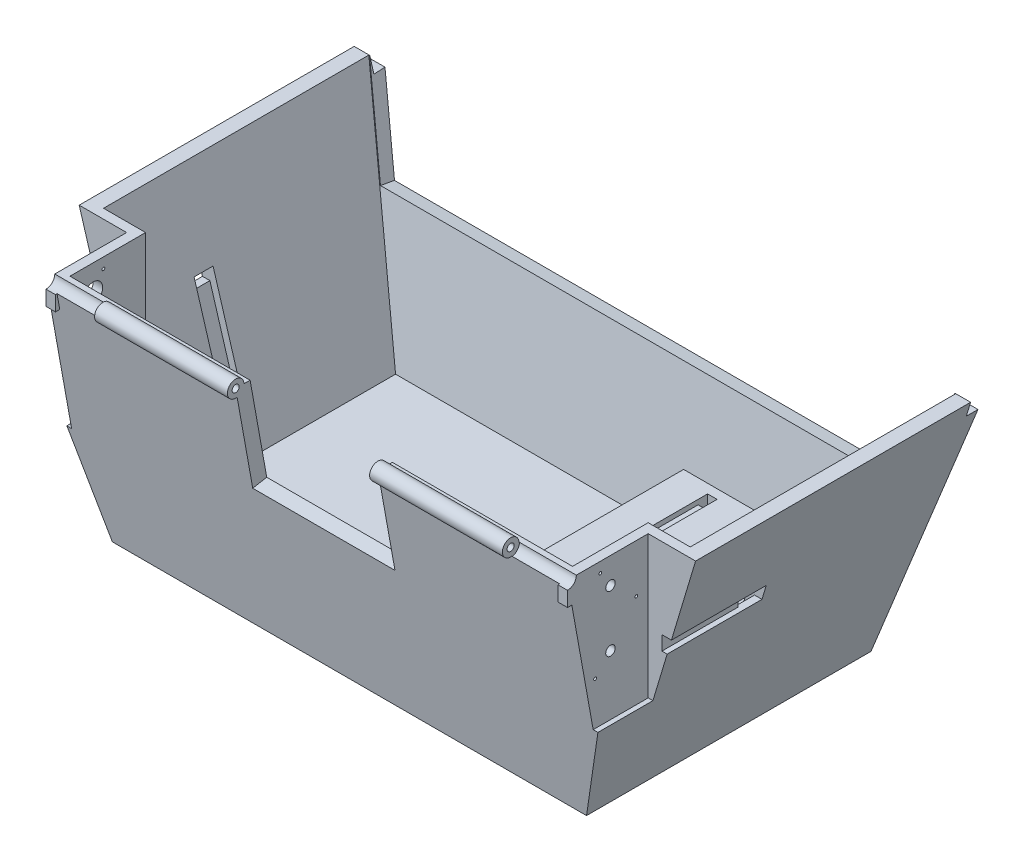
from build123d import *

# Parameters (mm, degrees)
SHELL_1_T                   = -3
CUT_EXTRUDE_START           = 55
SKETCH_4_W                  = 17
SKETCH_4_H                  = 30
CUT_EXTRUDE_1_DEPTH         = 36.807488848
CUT_EXTRUDE_START_2         = -55
SKETCH_4_2_W                = 17
SKETCH_4_2_H                = 30
CUT_EXTRUDE_2_DEPTH         = 36.807488848
EXTRUDE_START               = 55
SKETCH_4_3_W                = 17
SKETCH_4_3_H                = 30
EXTRUDE_1_DEPTH             = 2
EXTRUDE_START_2             = -55
SKETCH_4_4_W                = 17
SKETCH_4_4_H                = 30
EXTRUDE_2_DEPTH             = 2
SKETCH_5_R                  = 1.75
EXTRUDE_3_DEPTH             = 110
CUT_EXTRUDE_3_DEPTH         = 93.539856448
CUT_EXTRUDE_3_DEPTH_BACK    = 93.539856448
SKETCH_5_3_R                = 0.75
CUT_EXTRUDE_4_DEPTH         = 15
CUT_EXTRUDE_4_DEPTH_BACK    = 15
SKETCH_5_4_R                = 1.85
CUT_EXTRUDE_START_3         = -43
SKETCH_5_5_R                = 1.85
CUT_EXTRUDE_5_DEPTH         = 50.539856448
CUT_EXTRUDE_START_4         = 43
SKETCH_5_6_R                = 1.85
CUT_EXTRUDE_6_DEPTH         = 50.539856448
CUT_EXTRUDE_8_DEPTH         = 137.889097603
EXTRUDE_4_DEPTH             = 2
SKETCH_8_R                  = 0.3
SKETCH_8_R_2                = 2
CUT_EXTRUDE_9_DEPTH         = 2
SKETCH_9_R                  = 0.3
SKETCH_9_R_2                = 1
CUT_EXTRUDE_10_DEPTH        = 2
SKETCH_11_W                 = 60
SKETCH_11_H                 = 14
EXTRUDE_5_DEPTH             = 37
EXTRUDE_6_REACH             = 94.54
EXTRUDE_6_DIRECTION_2_REACH = 94.54
CUT_EXTRUDE_START_5         = -2
SKETCH_13_W                 = 36
SKETCH_13_H                 = 51
CUT_EXTRUDE_11_DEPTH        = 84.502193122
SKETCH_14_W                 = 1
SKETCH_14_H                 = 11
EXTRUDE_7_DEPTH             = 5
SKETCH_15_W                 = 8.8
SKETCH_15_H                 = 4.6
CUT_EXTRUDE_12_DEPTH        = 93.539856448
SKETCH_15_3_W               = 8.8
SKETCH_15_3_H               = 4.6
SKETCH_15_3_W_2             = 7
SKETCH_15_3_H_2             = 3
EXTRUDE_8_DEPTH             = 2
SKETCH_16_W                 = 3
SKETCH_16_H                 = 1.5
CUT_EXTRUDE_13_DEPTH        = 2
SKETCH_19_W                 = 2
SKETCH_19_H                 = 2
CUT_EXTRUDE_16_DEPTH        = 87.403848462
SKETCH_20_W                 = 19.1
SKETCH_20_H                 = 2
SKETCH_20_W_2               = 7
SKETCH_20_W_3               = 2
CUT_EXTRUDE_17_DEPTH        = 1
SKETCH_21_W                 = 24.1
SKETCH_21_H                 = 4.828212591
CUT_EXTRUDE_18_DEPTH        = 2.2
SKETCH_22_R                 = 0.75
CUT_EXTRUDE_19_DEPTH        = 3
CUT_EXTRUDE_20_DEPTH        = 3
CUT_EXTRUDE_21_DEPTH        = 93.539856448
CUT_EXTRUDE_21_DEPTH_BACK   = 93.539856448
SKETCH_24_W                 = 3
SKETCH_24_H                 = 3
SKETCH_25_W                 = 30
SKETCH_25_H                 = 20
CUT_EXTRUDE_22_DEPTH        = 108.611617512
CUT_EXTRUDE_23_DEPTH        = 20
SKETCH_27_W                 = 4
SKETCH_27_H                 = 3
CUT_EXTRUDE_24_DEPTH        = 140.438283994
SKETCH_28_W                 = 4
SKETCH_28_H                 = 17.604490414
CUT_EXTRUDE_25_DEPTH        = 1.5
SKETCH_29_W                 = 41.504647475
SKETCH_29_H                 = 4
CUT_EXTRUDE_26_DEPTH        = 1
SKETCH_30_W                 = 4
SKETCH_30_H                 = 29.088827574
CUT_EXTRUDE_27_DEPTH        = 1.5


with BuildPart() as part:
    # 草图1 → 放样1 section 0
    with BuildSketch(Plane(origin=(0, 0, 0), x_dir=(1, 0, 0), z_dir=(0, 1, 0))):
        with BuildLine():
            Line((-50, -30), (50, -30))
            Line((50, -30), (50, 30))
            Line((50, 30), (-50, 30))
            Line((-50, 30), (-50, -30))
        make_face()
    # 草图2 → 放样1 section 1
    with BuildSketch(Plane(origin=(0, 50, 0), x_dir=(1, 0, 0), z_dir=(0, 1, 0))):
        with BuildLine():
            Line((-65, -39), (65, -39))
            Line((65, -39), (65, 39))
            Line((65, 39), (-65, 39))
            Line((-65, 39), (-65, -39))
        make_face()
    loft()

    # 抽壳1
    shell_1_openings = [part.faces().sort_by_distance(p)[0] for p in [
        (0, 50, 0),
    ]]
    offset(amount=SHELL_1_T, openings=shell_1_openings, kind=Kind.INTERSECTION)

    # 草图4 → 切除-拉伸1 (cut, through all)
    with BuildSketch(Plane(origin=(0, 0, 0), x_dir=(0, 0, -1), z_dir=(1, 0, 0)).offset(CUT_EXTRUDE_START)):
        with Locations((-30.5, 35)):
            Rectangle(SKETCH_4_W, SKETCH_4_H)
    extrude(amount=CUT_EXTRUDE_1_DEPTH, mode=Mode.SUBTRACT)

    # 草图4<2> → 切除-拉伸2 (cut, through all)
    with BuildSketch(Plane(origin=(0, 0, 0), x_dir=(0, 0, -1), z_dir=(1, 0, 0)).offset(CUT_EXTRUDE_START_2)):
        with Locations((-30.5, 35)):
            Rectangle(SKETCH_4_2_W, SKETCH_4_2_H)
    extrude(amount=-CUT_EXTRUDE_2_DEPTH, mode=Mode.SUBTRACT)

    # 草图4<3> → 凸台-拉伸1 (add)
    with BuildSketch(Plane(origin=(0, 0, 0), x_dir=(0, 0, -1), z_dir=(1, 0, 0)).offset(EXTRUDE_START)):
        with Locations((-30.5, 35)):
            Rectangle(SKETCH_4_3_W, SKETCH_4_3_H)
    extrude(amount=-EXTRUDE_1_DEPTH)

    # 草图4<4> → 凸台-拉伸2 (add)
    with BuildSketch(Plane(origin=(0, 0, 0), x_dir=(0, 0, -1), z_dir=(1, 0, 0)).offset(EXTRUDE_START_2)):
        with Locations((-30.5, 35)):
            Rectangle(SKETCH_4_4_W, SKETCH_4_4_H)
    extrude(amount=EXTRUDE_2_DEPTH)

    # 草图5 → 凸台-拉伸3 (add)
    with BuildSketch(Plane(origin=(0, 0, 0), x_dir=(0, 0, -1), z_dir=(1, 0, 0)).offset(EXTRUDE_START)):
        with Locations((-39, 50)):
            Circle(SKETCH_5_R)
    extrude(amount=-EXTRUDE_3_DEPTH)

    # 草图5<3> → 切除-拉伸3 (cut, two sides: drawn at the far end of the back side and taken through both)
    with BuildSketch(Plane(origin=(0, 0, 0), x_dir=(0, 0, -1), z_dir=(1, 0, 0)).offset(-CUT_EXTRUDE_3_DEPTH_BACK)):
        with Locations((-39, 50)):
            Circle(SKETCH_5_3_R)
    extrude(amount=CUT_EXTRUDE_3_DEPTH + CUT_EXTRUDE_3_DEPTH_BACK, mode=Mode.SUBTRACT)

    # 草图5<4> → 切除-拉伸4 (cut, two sides: drawn at the far end of the back side and taken through both)
    with BuildSketch(Plane(origin=(0, 0, 0), x_dir=(0, 0, -1), z_dir=(1, 0, 0)).offset(-CUT_EXTRUDE_4_DEPTH_BACK)):
        with Locations((-39, 50)):
            Circle(SKETCH_5_4_R)
    extrude(amount=CUT_EXTRUDE_4_DEPTH + CUT_EXTRUDE_4_DEPTH_BACK, mode=Mode.SUBTRACT)

    # 草图5<5> → 切除-拉伸5 (cut, through all)
    with BuildSketch(Plane(origin=(0, 0, 0), x_dir=(0, 0, -1), z_dir=(1, 0, 0)).offset(CUT_EXTRUDE_START_3)):
        with Locations((-39, 50)):
            Circle(SKETCH_5_5_R)
    extrude(amount=-CUT_EXTRUDE_5_DEPTH, mode=Mode.SUBTRACT)

    # 草图5<6> → 切除-拉伸6 (cut, through all)
    with BuildSketch(Plane(origin=(0, 0, 0), x_dir=(0, 0, -1), z_dir=(1, 0, 0)).offset(CUT_EXTRUDE_START_4)):
        with Locations((-39, 50)):
            Circle(SKETCH_5_6_R)
    extrude(amount=CUT_EXTRUDE_6_DEPTH, mode=Mode.SUBTRACT)

    # 草图6 → 切除-拉伸8 (cut, through all)
    with BuildSketch(Plane(origin=(55, 0, 0), x_dir=(0, 0, -1), z_dir=(1, 0, 0))):
        Polygon((-39, 20), (-33.6, 20), (-38.1, 45), (-39, 45), align=None)
    extrude(amount=-CUT_EXTRUDE_8_DEPTH, mode=Mode.SUBTRACT)

    # 草图7 → 凸台-拉伸4 (add)
    with BuildSketch(Plane(origin=(0, 0, 22), x_dir=(-1, 0, 0), z_dir=(0, 0, -1))):
        Polygon((-65, 50), (-56, 20), (-53, 20), (-53, 50), align=None)
        Polygon((65, 50), (56, 20), (53, 20), (53, 50), align=None)
    extrude(amount=EXTRUDE_4_DEPTH)

    # 草图8 → 切除-拉伸9 (cut)
    with BuildSketch(Plane.ZY.offset(55)):
        with Locations((27.8, 29.1)):
            Circle(SKETCH_8_R)
        with Locations((28.9, 47.8)):
            Circle(SKETCH_8_R)
        with Locations((36.5, 39.8)):
            Circle(SKETCH_8_R)
        with Locations((31.05, 44.5)):
            Circle(SKETCH_8_R_2)
        with Locations((31.05, 32.615203148)):
            Circle(SKETCH_8_R_2)
    extrude(amount=-CUT_EXTRUDE_9_DEPTH, mode=Mode.SUBTRACT)

    # 草图9 → 切除-拉伸10 (cut)
    with BuildSketch(Plane(origin=(55, 0, 0), x_dir=(0, 0, -1), z_dir=(1, 0, 0))):
        with Locations((-32.1, 47.8)):
            Circle(SKETCH_9_R)
        with Locations((-33.2, 29.1)):
            Circle(SKETCH_9_R)
        with Locations((-24.5, 39.8)):
            Circle(SKETCH_9_R)
        with Locations((-29.95, 44.5)):
            Circle(SKETCH_9_R_2)
        with Locations((-29.95, 32.6)):
            Circle(SKETCH_9_R_2)
    extrude(amount=-CUT_EXTRUDE_10_DEPTH, mode=Mode.SUBTRACT)

    # 草图11 → 凸台-拉伸5 (add)
    with BuildSketch(Plane(origin=(48, 0, 0), x_dir=(0, 0, -1), z_dir=(1, 0, 0))):
        with Locations((0, 7)):
            Rectangle(SKETCH_11_W, SKETCH_11_H)
    extrude(amount=-EXTRUDE_5_DEPTH)

    # 凸台-拉伸6: up to this plane
    extrude_6_end = Plane(origin=(0, -4.699071807, 26.105954484), z_dir=(0, 0.17715299831526513, -0.9841833239736953))
    # 草图12 → 凸台-拉伸6 (add, up to the surface)
    with BuildSketch(Plane.XY, mode=Mode.PRIVATE) as extrude_6_sk1:
        Polygon((48, 14), (51.067908047, 14), (48, 3.773639842), align=None)
    extrude_6_tool1 = split(extrude(extrude_6_sk1.sketch, amount=EXTRUDE_6_REACH, mode=Mode.PRIVATE), bisect_by=extrude_6_end, keep=Keep.BOTH, mode=Mode.PRIVATE)
    add(extrude_6_tool1.solids().sort_by_distance((49.022636, 10.591213, 0))[0])

    # 凸台-拉伸6 direction 2: up to this plane
    extrude_6_direction_2_end = Plane(origin=(0, -4.699071807, -26.105954484), z_dir=(0, 0.17715299831526524, 0.9841833239736953))
    # 草图12 → 凸台-拉伸6 direction 2 (add, up to the surface)
    with BuildSketch(Plane.XY, mode=Mode.PRIVATE) as extrude_6_direction_2_sk1:
        Polygon((48, 14), (51.067908047, 14), (48, 3.773639842), align=None)
    extrude_6_direction_2_tool1 = split(extrude(extrude_6_direction_2_sk1.sketch, amount=-EXTRUDE_6_DIRECTION_2_REACH, mode=Mode.PRIVATE), bisect_by=extrude_6_direction_2_end, keep=Keep.BOTH, mode=Mode.PRIVATE)
    add(extrude_6_direction_2_tool1.solids().sort_by_distance((49.022636, 10.591213, 0))[0])

    # 草图13 → 切除-拉伸11 (cut, through all)
    with BuildSketch(Plane(origin=(0, 14, 0), x_dir=(1, 0, 0), z_dir=(0, 1, 0)).offset(CUT_EXTRUDE_START_5)):
        with Locations((31, 2.028212591)):
            Rectangle(SKETCH_13_W, SKETCH_13_H)
    extrude(amount=-CUT_EXTRUDE_11_DEPTH, mode=Mode.SUBTRACT)

    # 草图14 → 凸台-拉伸7 (add)
    with BuildSketch(Plane.XZ.offset(-12)):
        with Locations((25, -2.028212591)):
            Rectangle(SKETCH_14_W, SKETCH_14_H)
        with Locations((37, -2.028212591)):
            Rectangle(SKETCH_14_W, SKETCH_14_H)
    extrude(amount=EXTRUDE_7_DEPTH)

    # 草图15 → 切除-拉伸12 (cut, through all)
    with BuildSketch(Plane.XZ):
        with Locations((18.5, 26.8)):
            Rectangle(SKETCH_15_W, SKETCH_15_H)
    extrude(amount=-CUT_EXTRUDE_12_DEPTH, mode=Mode.SUBTRACT)

    # 草图16 → 切除-拉伸13 (cut)
    with BuildSketch(Plane.XY.offset(-27.528212591)):
        with Locations((25, 1.75)):
            Rectangle(SKETCH_16_W, SKETCH_16_H)
        with Locations((37, 1.75)):
            Rectangle(SKETCH_16_W, SKETCH_16_H)
    extrude(amount=-CUT_EXTRUDE_13_DEPTH, mode=Mode.SUBTRACT)

    # 草图19 → 切除-拉伸16 (cut, through all)
    with BuildSketch(Plane.XZ.offset(-12)):
        with Locations((43, 22.471787409)):
            Rectangle(SKETCH_19_W, SKETCH_19_H)
        with Locations((19, -26.528212591)):
            Rectangle(SKETCH_19_W, SKETCH_19_H)
    extrude(amount=-CUT_EXTRUDE_16_DEPTH, mode=Mode.SUBTRACT)

    # 草图20 → 切除-拉伸17 (cut)
    with BuildSketch(Plane(origin=(0, 14, 0), x_dir=(1, 0, 0), z_dir=(0, 1, 0))):
        Polygon((44, -23.471787409), (42, -23.471787409), (42, -25.8), (42, -27.8), (44, -27.8), align=None)
        with Locations((32.45, -26.8)):
            Rectangle(SKETCH_20_W, SKETCH_20_H)
        Polygon((20, 25.528212591), (18, 25.528212591), (18, -20.5), (18, -22.5), (20, -22.5), align=None)
        with Locations((14.5, -21.5)):
            Rectangle(SKETCH_20_W_2, SKETCH_20_H)
        with Locations((19, -23.5)):
            Rectangle(SKETCH_20_W_3, SKETCH_20_H)
    extrude(amount=-CUT_EXTRUDE_17_DEPTH, mode=Mode.SUBTRACT)

    # 草图21 → 切除-拉伸18 (cut)
    with BuildSketch(Plane.XZ):
        with Locations((36.95, 25.885893704)):
            Rectangle(SKETCH_21_W, SKETCH_21_H)
    extrude(amount=-CUT_EXTRUDE_18_DEPTH, mode=Mode.SUBTRACT)

    # 草图22 → 切除-拉伸19 (cut)
    with BuildSketch(Plane.XZ.offset(-2.2)):
        with Locations(Location((37, 25.471787409, 0), (0, 0, 270))):
            Circle(SKETCH_22_R)
    extrude(amount=-CUT_EXTRUDE_19_DEPTH, mode=Mode.SUBTRACT)

    # 草图23 → 切除-拉伸20 (cut)
    with BuildSketch(Plane(origin=(0, -5.230530802, -29.058504456), x_dir=(-1, 0, 0), z_dir=(0, -0.1771529983152653, -0.9841833239736953))):
        Polygon((-61.867908047, 56.118133133), (-55.962808103, 36.118133133), (55.962808103, 36.118133133), (61.867908047, 56.118133133), align=None)
    extrude(amount=-CUT_EXTRUDE_20_DEPTH, mode=Mode.SUBTRACT)

    # 草图24 → 切除-拉伸21 (cut, two sides: drawn at the far end of the back side and taken through both)
    with BuildSketch(Plane(origin=(0, 0, 0), x_dir=(0, 0, -1), z_dir=(1, 0, 0)).offset(-CUT_EXTRUDE_21_DEPTH_BACK)):
        with Locations((37.5, 48.5)):
            Rectangle(SKETCH_24_W, SKETCH_24_H)
    extrude(amount=CUT_EXTRUDE_21_DEPTH + CUT_EXTRUDE_21_DEPTH_BACK, mode=Mode.SUBTRACT)

    # 草图25 → 切除-拉伸22 (cut, through all)
    with BuildSketch(Plane(origin=(0, -4.699071807, 26.105954484), x_dir=(-1, 0, 0), z_dir=(0, 0.17715299831526515, -0.9841833239736952))):
        with Locations((0, 45.790400086)):
            Rectangle(SKETCH_25_W, SKETCH_25_H)
    extrude(amount=-CUT_EXTRUDE_22_DEPTH, mode=Mode.SUBTRACT)

    # 草图26 → 切除-拉伸23 (cut)
    with BuildSketch(Plane.XY.offset(22)):
        Polygon((59, 30), (59.9, 33), (57.9, 33), (57.9, 30), align=None)
        Polygon((-59.9, 33), (-57.9, 33), (-57.9, 30), (-59, 30), align=None)
    extrude(amount=-CUT_EXTRUDE_23_DEPTH, mode=Mode.SUBTRACT)

    # 草图27 → 切除-拉伸24 (cut, through all)
    with BuildSketch(Plane.ZY.offset(57.9)):
        with Locations((4, 31.5)):
            Rectangle(SKETCH_27_W, SKETCH_27_H)
    extrude(amount=-CUT_EXTRUDE_24_DEPTH, mode=Mode.SUBTRACT)

    # 草图28 → 切除-拉伸25 (cut)
    with BuildSketch(Plane(origin=(42.998080777, -12.899424233, 0), x_dir=(0, 0, 1), z_dir=(-0.9578262852211515, 0.2873478855663453, 0))):
        with Locations((4, 36.886068598)):
            Rectangle(SKETCH_28_W, SKETCH_28_H)
    extrude(amount=-CUT_EXTRUDE_25_DEPTH, mode=Mode.SUBTRACT)

    # 草图29 → 切除-拉伸26 (cut)
    with BuildSketch(Plane(origin=(0, 14, 0), x_dir=(1, 0, 0), z_dir=(0, 1, 0))):
        with Locations((31.752323738, -4)):
            Rectangle(SKETCH_29_W, SKETCH_29_H)
    extrude(amount=-CUT_EXTRUDE_26_DEPTH, mode=Mode.SUBTRACT)

    # 草图30 → 切除-拉伸27 (cut)
    with BuildSketch(Plane(origin=(-42.998080777, -12.899424233, 0), x_dir=(0, 0, -1), z_dir=(0.9578262852211514, 0.28734788556634555, 0))):
        with Locations((-4, 31.143900018)):
            Rectangle(SKETCH_30_W, SKETCH_30_H)
    extrude(amount=-CUT_EXTRUDE_27_DEPTH, mode=Mode.SUBTRACT)


with BuildPart() as body_2:
    # 草图15<3> → 凸台-拉伸8 (new body)
    with BuildSketch(Plane.XZ):
        with Locations((18.5, 26.8)):
            Rectangle(SKETCH_15_3_W, SKETCH_15_3_H)
        with Locations((18.5, 26.8)):
            Rectangle(SKETCH_15_3_W_2, SKETCH_15_3_H_2, mode=Mode.SUBTRACT)
    extrude(amount=-EXTRUDE_8_DEPTH)


solid = Compound([part.part, body_2.part])
